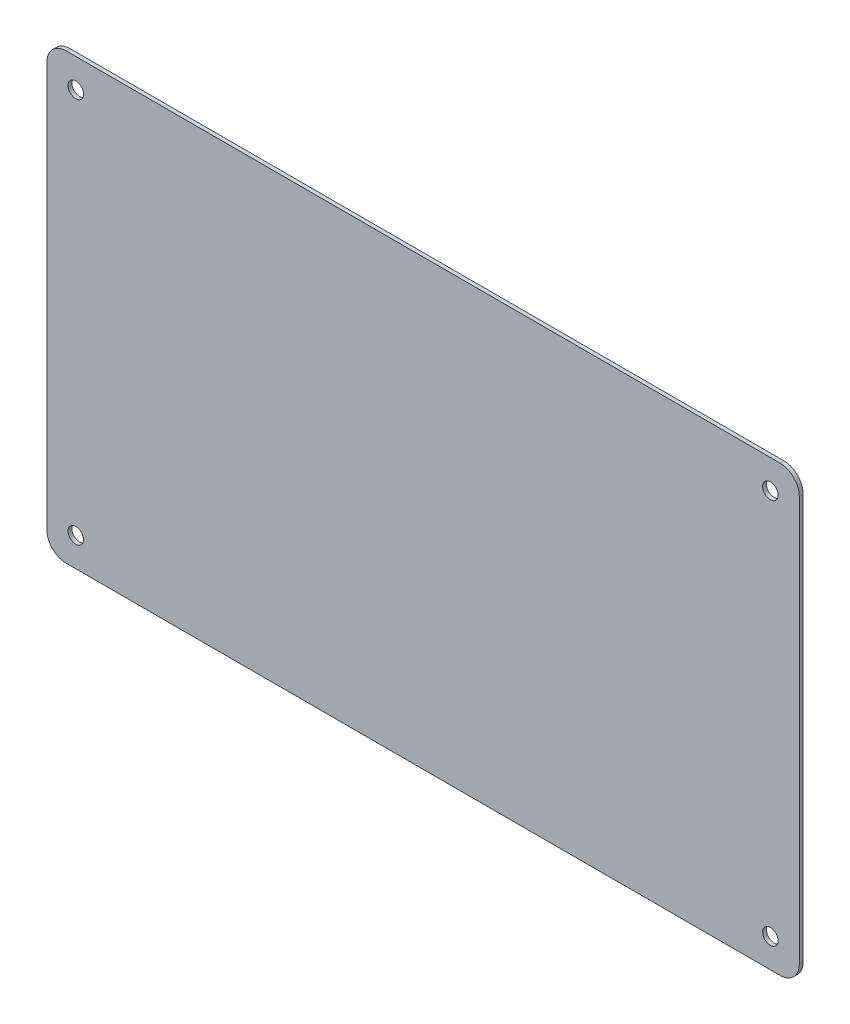
from build123d import *

# Parameters (mm, degrees)
EXTRUDE_1_DEPTH     = 0.4
SKETCH_2_R          = 0.8
CUT_EXTRUDE_1_DEPTH = 1


with BuildPart() as part:
    # Эскиз1 → Бобышка-Вытянуть1 (new body)
    with BuildSketch(Plane.XY):
        with BuildLine():
            Line((-37, 23), (37, 23))
            ThreePointArc((37, 23), (38.414213562, 22.414213562), (39, 21))
            Line((39, 21), (39, -21))
            ThreePointArc((39, -21), (38.414213562, -22.414213562), (37, -23))
            Line((37, -23), (-37, -23))
            ThreePointArc((-37, -23), (-38.414213562, -22.414213562), (-39, -21))
            Line((-39, -21), (-39, 21))
            ThreePointArc((-39, 21), (-38.414213562, 22.414213562), (-37, 23))
        make_face()
    extrude(amount=EXTRUDE_1_DEPTH)

    # Эскиз2 → Вырез-Вытянуть1 (cut)
    with BuildSketch(Plane.XY.offset(0.4)):
        with Locations((-36, 20)):
            Circle(SKETCH_2_R)
        with Locations((36, 20)):
            Circle(SKETCH_2_R)
        with Locations((36, -20)):
            Circle(SKETCH_2_R)
        with Locations((-36, -20)):
            Circle(SKETCH_2_R)
    extrude(amount=-CUT_EXTRUDE_1_DEPTH, mode=Mode.SUBTRACT)


solid = part.part
